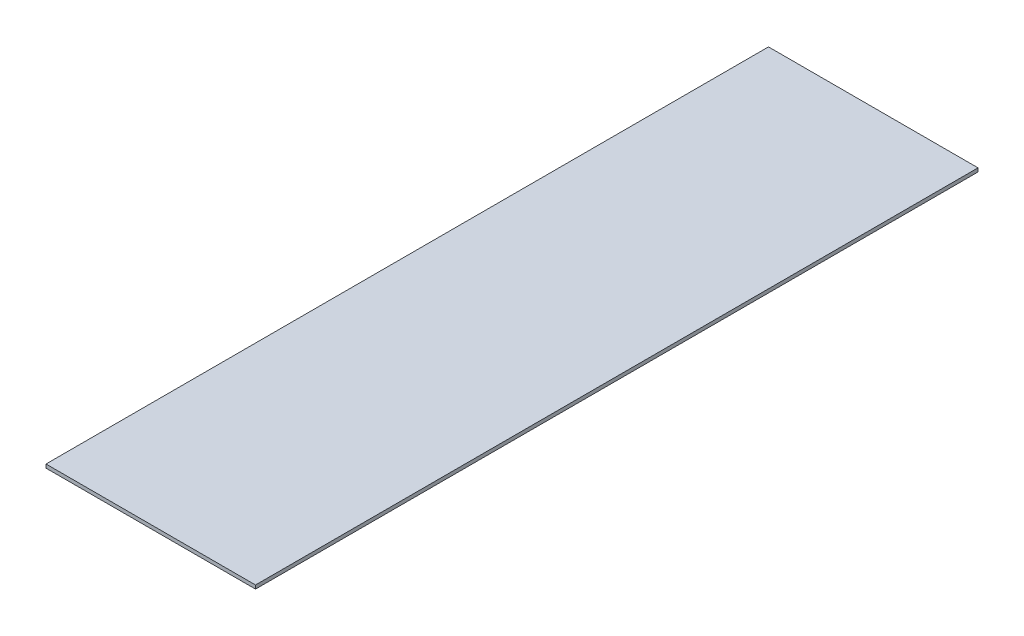
from build123d import *

# Parameters (mm, degrees)
SKETCH1_W           = 184.15
SKETCH1_H           = 685.8
BOSS_EXTRUDE1_DEPTH = 3.175
SKETCH2_W           = 184.15
SKETCH2_H           = 50.8
CUT_EXTRUDE1_DEPTH  = 711.100657037


with BuildPart() as part:
    # Sketch1 → Boss-Extrude1 (new body)
    with BuildSketch(Plane(origin=(0, 0, 0), x_dir=(1, 0, 0), z_dir=(0, 1, 0))):
        with Locations((92.075, 342.9)):
            Rectangle(SKETCH1_W, SKETCH1_H)
    extrude(amount=BOSS_EXTRUDE1_DEPTH)

    # Sketch2 → Cut-Extrude1 (cut, through all)
    with BuildSketch(Plane(origin=(0, 3.175, 0), x_dir=(1, 0, 0), z_dir=(0, 1, 0))):
        with Locations((92.075, 25.4)):
            Rectangle(SKETCH2_W, SKETCH2_H)
    extrude(amount=-CUT_EXTRUDE1_DEPTH, mode=Mode.SUBTRACT)


solid = part.part
